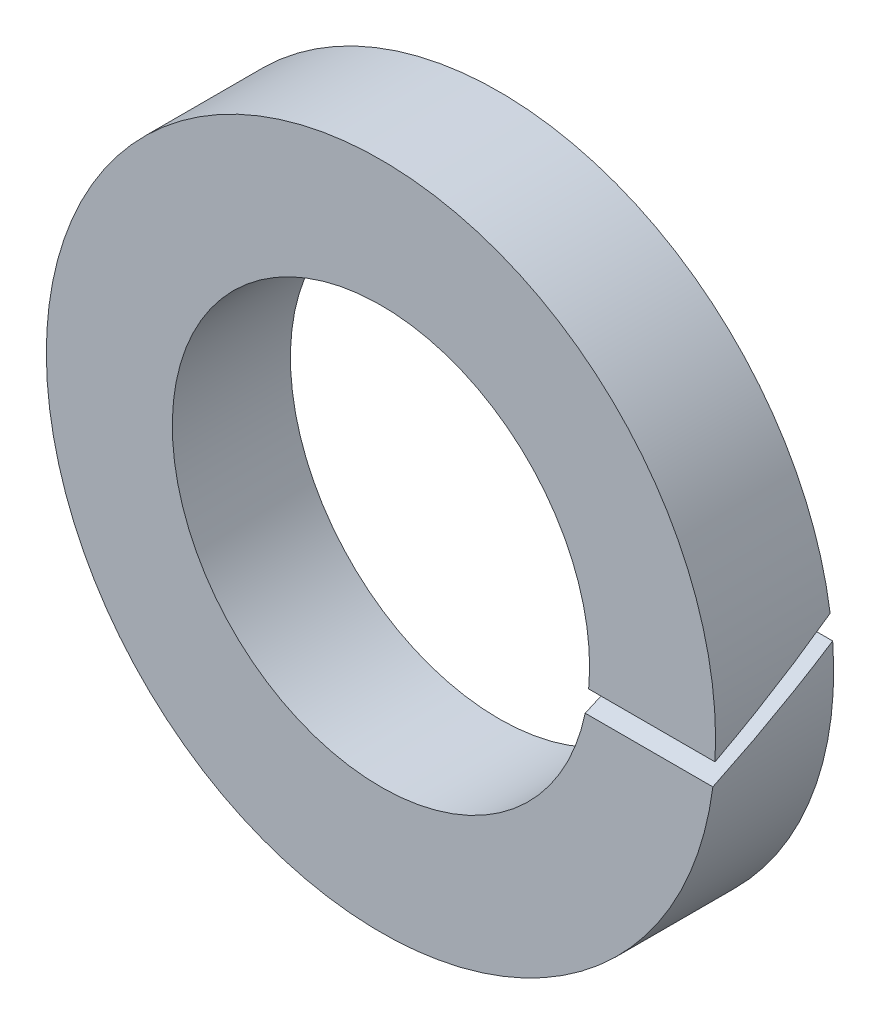
from build123d import *

# Parameters (mm, degrees)
ESQUISSE1_R             = 4.25
ESQUISSE1_R_2           = 2.65
EXTRUSION1_DEPTH        = 1.5
ENL_V_MAT_EXTRU_1_DEPTH = 7.194755847


with BuildPart() as part:
    # Esquisse1 → Extrusion1 (new body)
    with BuildSketch(Plane.XY):
        Circle(ESQUISSE1_R)
        Circle(ESQUISSE1_R_2, mode=Mode.SUBTRACT)
    extrude(amount=EXTRUSION1_DEPTH)

    # Esquisse2 → Enlèv. mat.-Extru.1 (cut, through all)
    with BuildSketch(Plane(origin=(0, 0, 0), x_dir=(0, 0, -1), z_dir=(1, 0, 0))):
        Polygon((-1.5, -0.251883141), (0, 0.614142263), (0, 0.325467128), (-1.5, -0.540558276), align=None)
    extrude(amount=ENL_V_MAT_EXTRU_1_DEPTH, mode=Mode.SUBTRACT)


solid = part.part
